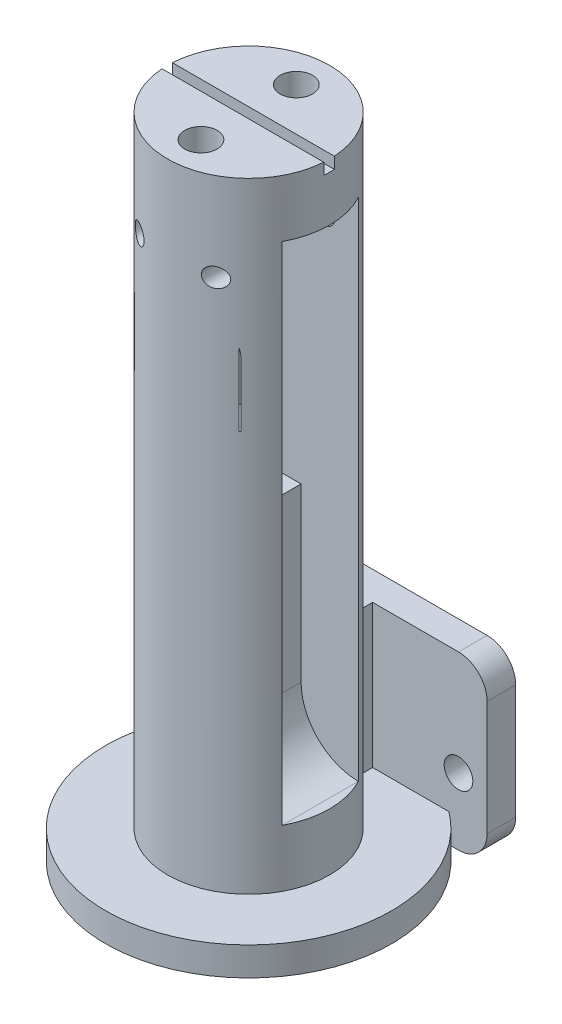
from build123d import *

# Parameters (mm, degrees)
CROQUIS1_R                   = 15
SALIENTE_EXTRUIR1_DEPTH      = 3
CROQUIS2_R                   = 8.5
SALIENTE_EXTRUIR2_DEPTH      = 65
CORTAR_EXTRUIR1_DEPTH        = 4
CORTAR_EXTRUIR1_DEPTH_BACK   = 4
CROQUIS3_W                   = 17
CROQUIS3_H                   = 53
CORTAR_EXTRUIR2_DEPTH        = 8
CORTAR_EXTRUIR2_DEPTH_BACK   = 8
CROQUIS4_R                   = 1
CUT_EXTRUDE9_DEPTH           = 2.5
CROQUIS5_W                   = 2
CROQUIS5_H                   = 15
SALIENTE_EXTRUIR3_DEPTH      = 15
CROQUIS6_R                   = 1.5
SALIENTE_EXTRUIR4_DEPTH      = 3
SALIENTE_EXTRUIR5_DEPTH      = 1.5
SALIENTE_EXTRUIR5_DEPTH_BACK = 1.5
REDONDEO2_R                  = 6
CROQUIS8_R                   = 3
CORTAR_EXTRUIR3_DEPTH        = 10
SKETCH1_W                    = 5
SKETCH1_H                    = 5
CUT_EXTRUDE1_DEPTH           = 1
SKETCH2_R                    = 1.25
CUT_EXTRUDE2_DEPTH           = 3
CUT_EXTRUDE10_START          = -1.2
CUT_EXTRUDE10_DEPTH          = 1.2
M3_CLEARANCE_HOLE1_D         = 3.4
M3_CLEARANCE_HOLE1_DEPTH     = 3.978536948
M3_CLEARANCE_HOLE1_TIP       = 1.021463052


with BuildPart() as part:
    # Croquis1 → Saliente-Extruir1 (new body)
    with BuildSketch(Plane(origin=(0, 0, 0), x_dir=(1, 0, 0), z_dir=(0, 1, 0))):
        Circle(CROQUIS1_R)
    extrude(amount=SALIENTE_EXTRUIR1_DEPTH)

    # Croquis2 → Saliente-Extruir2 (add)
    with BuildSketch(Plane(origin=(0, 3, 0), x_dir=(1, 0, 0), z_dir=(0, 1, 0))):
        Circle(CROQUIS2_R)
    extrude(amount=SALIENTE_EXTRUIR2_DEPTH)

    # Croquis3 → Cortar-Extruir1 (cut, two sides: drawn at the far end of the back side and taken through both)
    with BuildSketch(Plane.XY.offset(-CORTAR_EXTRUIR1_DEPTH_BACK)):
        with Locations((0, 35.5)):
            Rectangle(CROQUIS3_W, CROQUIS3_H)
    extrude(amount=CORTAR_EXTRUIR1_DEPTH + CORTAR_EXTRUIR1_DEPTH_BACK, mode=Mode.SUBTRACT)

    # Croquis4 → Cortar-Extruir2 (cut, two sides: drawn at the far end of the back side and taken through both)
    with BuildSketch(Plane.XY.offset(-CORTAR_EXTRUIR2_DEPTH_BACK)):
        with Locations((-4, 58.75)):
            Circle(CROQUIS4_R)
        with Locations((4, 58.75)):
            Circle(CROQUIS4_R)
    extrude(amount=CORTAR_EXTRUIR2_DEPTH + CORTAR_EXTRUIR2_DEPTH_BACK, mode=Mode.SUBTRACT)

    # Sketch11 → Cut-Extrude9 (cut)
    with BuildSketch(Plane(origin=(0, 0, 4), x_dir=(-1, 0, 0), z_dir=(0, 0, -1))):
        with BuildLine():
            Line((5.6, 51.5), (5.6, 45))
            Line((5.6, 45), (-5.6, 45))
            Line((-5.6, 45), (-5.6, 51.5))
            ThreePointArc((-5.6, 51.5), (0, 57.1), (5.6, 51.5))
        make_face()
    extrude(amount=-CUT_EXTRUDE9_DEPTH, mode=Mode.SUBTRACT)

    # Croquis5 → Saliente-Extruir3 (add)
    with BuildSketch(Plane.XY):
        with Locations((0, 10.5)):
            Rectangle(CROQUIS5_W, CROQUIS5_H)
    extrude(amount=-SALIENTE_EXTRUIR3_DEPTH)

    # Croquis6 → Saliente-Extruir4 (add)
    with BuildSketch(Plane(origin=(0, 0, -15), x_dir=(-1, 0, 0), z_dir=(0, 0, -1))):
        with BuildLine():
            Line((-10, 0), (10, 0))
            ThreePointArc((10, 0), (12.121320344, 0.878679656), (13, 3))
            Line((13, 3), (13, 15))
            ThreePointArc((13, 15), (12.121320344, 17.121320344), (10, 18))
            Line((10, 18), (-10, 18))
            ThreePointArc((-10, 18), (-12.121320344, 17.121320344), (-13, 15))
            Line((-13, 15), (-13, 3))
            ThreePointArc((-13, 3), (-12.121320344, 0.878679656), (-10, 0))
        make_face()
        with Locations((-10, 7)):
            Circle(CROQUIS6_R, mode=Mode.SUBTRACT)
        with Locations((10, 7)):
            Circle(CROQUIS6_R, mode=Mode.SUBTRACT)
    extrude(amount=-SALIENTE_EXTRUIR4_DEPTH)

    # Croquis7 → Saliente-Extruir5 (add, two sides: drawn at the far end of the back side and taken through both)
    with BuildSketch(Plane(origin=(0, 0, 0), x_dir=(0, 0, -1), z_dir=(1, 0, 0)).offset(-SALIENTE_EXTRUIR5_DEPTH_BACK)):
        Polygon((0, 9), (4, 9), (4, 33), (-4, 33), (-4, 9), align=None)
    extrude(amount=SALIENTE_EXTRUIR5_DEPTH + SALIENTE_EXTRUIR5_DEPTH_BACK)

    # Redondeo2
    redondeo2_edges = [part.edges().sort_by_distance(p)[0] for p in [
        (-1.5, 9, 0),
        (1.5, 9, 0),
    ]]
    fillet(redondeo2_edges, radius=REDONDEO2_R)

    # Croquis8 → Cortar-Extruir3 (cut)
    with BuildSketch(Plane.XZ):
        Circle(CROQUIS8_R)
    extrude(amount=-CORTAR_EXTRUIR3_DEPTH, mode=Mode.SUBTRACT)

    # Sketch1 → Cut-Extrude1 (cut)
    with BuildSketch(Plane.ZY.offset(1.5)):
        with Locations((0, 20.5)):
            Rectangle(SKETCH1_W, SKETCH1_H)
    extrude(amount=-CUT_EXTRUDE1_DEPTH, mode=Mode.SUBTRACT)

    # Sketch2 → Cut-Extrude2 (cut)
    with BuildSketch(Plane.ZY.offset(0.5)):
        with Locations((0, 20.5)):
            Circle(SKETCH2_R)
    extrude(amount=-CUT_EXTRUDE2_DEPTH, mode=Mode.SUBTRACT)

    # Sketch12 → Cut-Extrude10 (cut)
    with BuildSketch(Plane(origin=(0, 68, 0), x_dir=(1, 0, 0), z_dir=(0, 1, 0)).offset(CUT_EXTRUDE10_START)):
        with BuildLine():
            Line((0, 0.499987676), (-8.4852821, 0.499987676))
            ThreePointArc((-8.4852821, 0.499987676), (-8.499852285, -0.050111177), (-8.478797084, -0.6))
            Line((-8.478797084, -0.6), (0, -0.6))
            Line((0, -0.6), (8.478797084, -0.6))
            ThreePointArc((8.478797084, -0.6), (8.499852285, -0.050111177), (8.4852821, 0.499987676))
            Line((8.4852821, 0.499987676), (0, 0.499987676))
        make_face()
    extrude(amount=CUT_EXTRUDE10_DEPTH, mode=Mode.SUBTRACT)

    # M3 Clearance Hole1
    with Locations(Plane(origin=(0, 68, 0), x_dir=(1, 0, 0), z_dir=(0, 1, 0))):
        with Locations((0, 5), (0, -5)):
            Hole(M3_CLEARANCE_HOLE1_D / 2, depth=M3_CLEARANCE_HOLE1_DEPTH)
            with Locations((0, 0, -(M3_CLEARANCE_HOLE1_DEPTH + M3_CLEARANCE_HOLE1_TIP / 2))):  # 118° drill point
                Cone(0, M3_CLEARANCE_HOLE1_D / 2, M3_CLEARANCE_HOLE1_TIP, mode=Mode.SUBTRACT)


solid = part.part
